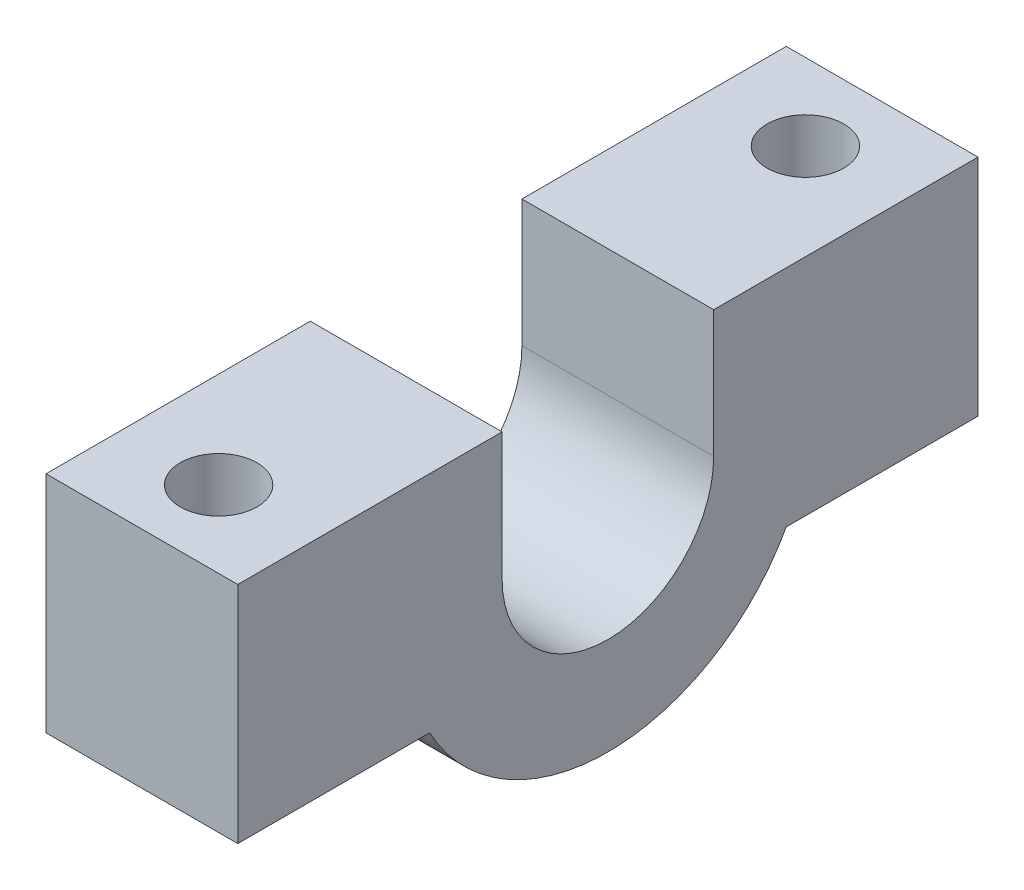
from build123d import *

# Parameters (mm, degrees)
BOSS_EXTRUDE1_DEPTH = 20
CUT_EXTRUDE1_REACH  = 57.463
SKETCH3_R           = 4


with BuildPart() as part:
    # Sketch2 → Boss-Extrude1 (new body)
    with BuildSketch(Plane(origin=(0, 0, 0), x_dir=(0, 0, -1), z_dir=(1, 0, 0))):
        with BuildLine():
            Line((-18.601140422, -10.16), (-38.601140422, -10.16))
            Line((-38.601140422, -10.16), (-38.601140422, 0))
            Line((-38.601140422, 0), (-38.601140422, 13.245))
            Line((-38.601140422, 13.245), (-11.035, 13.245))
            Line((-11.035, 13.245), (-11.035, 0))
            ThreePointArc((-11.035, 0), (0, -11.035), (11.035, 0))
            Line((11.035, 0), (11.035, 13.245))
            Line((11.035, 13.245), (38.601140422, 13.245))
            Line((38.601140422, 13.245), (38.601140422, -10.16))
            Line((38.601140422, -10.16), (18.601140422, -10.16))
            ThreePointArc((18.601140422, -10.16), (0, -21.195), (-18.601140422, -10.16))
        make_face()
    extrude(amount=BOSS_EXTRUDE1_DEPTH)

    # Sketch3 → Cut-Extrude1 (cut, up to next)
    with BuildSketch(Plane(origin=(0, 13.245, 0), x_dir=(1, 0, 0), z_dir=(0, 1, 0)), mode=Mode.PRIVATE) as cut_extrude1_sk1:
        with Locations(Location((10, -30.6, 0), (0, 0, 270))):
            Circle(SKETCH3_R)
    cut_extrude1_tool1 = extrude(cut_extrude1_sk1.sketch, amount=-CUT_EXTRUDE1_REACH, mode=Mode.PRIVATE) & part.part
    # Sketch3 → Cut-Extrude1 (cut, up to next)
    with BuildSketch(Plane(origin=(0, 13.245, 0), x_dir=(1, 0, 0), z_dir=(0, 1, 0)), mode=Mode.PRIVATE) as cut_extrude1_sk2:
        with Locations(Location((10, 30.6, 0), (0, 0, 270))):
            Circle(SKETCH3_R)
    cut_extrude1_tool2 = extrude(cut_extrude1_sk2.sketch, amount=-CUT_EXTRUDE1_REACH, mode=Mode.PRIVATE) & part.part
    add(cut_extrude1_tool1.solids().sort_by_distance((10, 13.245, 30.6))[0], mode=Mode.SUBTRACT)
    add(cut_extrude1_tool2.solids().sort_by_distance((10, 13.245, -30.6))[0], mode=Mode.SUBTRACT)


solid = part.part
